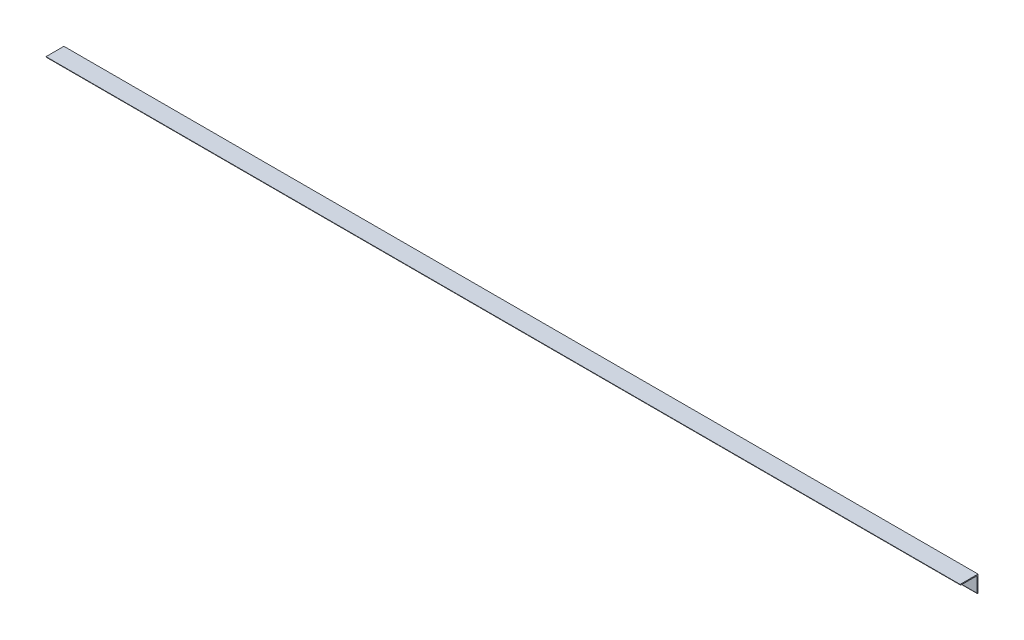
from build123d import *

# Parameters (mm, degrees)
ANGLE_IRON_35_X_35_X_5_2_DEPTH = 4595


with BuildPart() as part:
    # Sketch13 → Angle iron 35 X 35 X 5(2) (new body)
    with BuildSketch(Plane(origin=(0, 0, 0), x_dir=(0, -1, 0), z_dir=(-1, 0, 0))):
        with BuildLine():
            Line((0, 0), (0, 90))
            ThreePointArc((0, 90), (3.535533906, 88.535533906), (5, 85))
            Line((5, 85), (5, 10))
            ThreePointArc((5, 10), (6.464466094, 6.464466094), (10, 5))
            Line((10, 5), (80, 5))
            ThreePointArc((80, 5), (83.535533906, 3.535533906), (85, 0))
            Line((85, 0), (0, 0))
        make_face()
    extrude(amount=ANGLE_IRON_35_X_35_X_5_2_DEPTH)


solid = part.part
